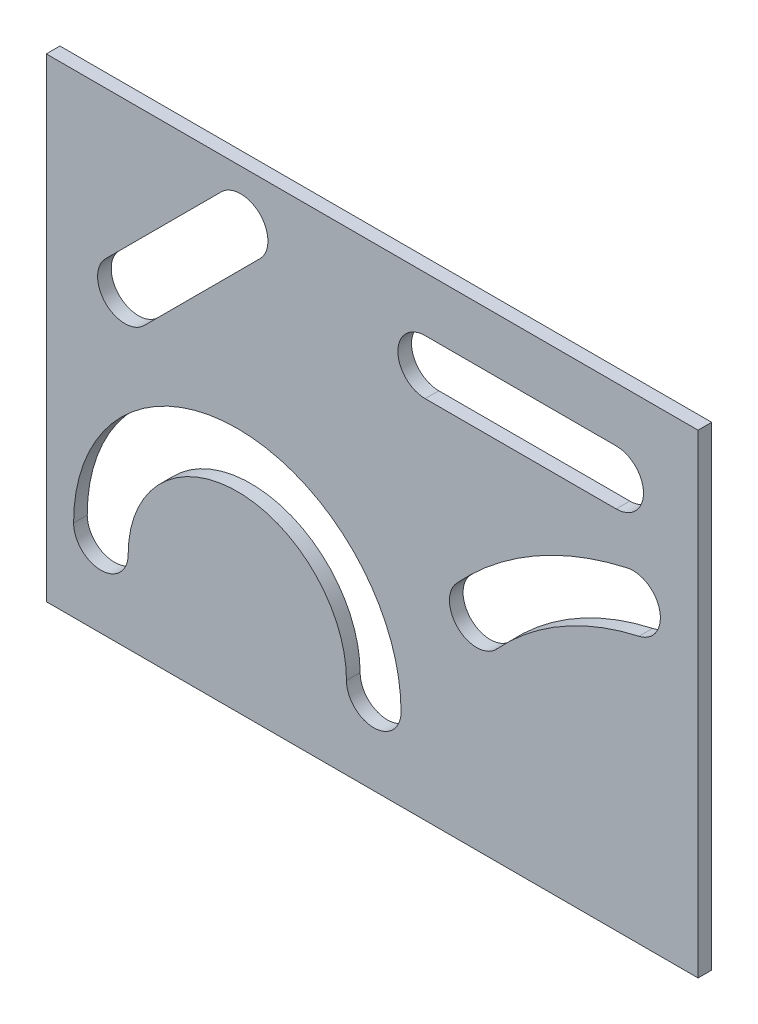
from build123d import *

# Parameters (mm, degrees)
SKETCH1_W           = 477.670351936
SKETCH1_H           = 347.715917952
BOSS_EXTRUDE1_DEPTH = 10
CUT_EXTRUDE1_DEPTH  = 10


with BuildPart() as part:
    # Sketch1 → Boss-Extrude1 (new body)
    with BuildSketch(Plane.XY):
        Rectangle(SKETCH1_W, SKETCH1_H)
    extrude(amount=BOSS_EXTRUDE1_DEPTH)

    # Sketch2 → Cut-Extrude1 (cut)
    with BuildSketch(Plane.XY.offset(10)):
        with BuildLine():
            Line((-195.403718463, 65.573687729), (-110.55090472, 150.426501471))
            ThreePointArc((-110.55090472, 150.426501471), (-82.266633473, 150.426501471), (-82.266633473, 122.142230224))
            Line((-82.266633473, 122.142230224), (-167.119447215, 37.289416482))
            ThreePointArc((-167.119447215, 37.289416482), (-195.403718463, 37.289416482), (-195.403718463, 65.573687729))
        make_face()
        with BuildLine():
            Line((38.835175968, 133.857958976), (178.835175968, 133.857958976))
            ThreePointArc((178.835175968, 133.857958976), (198.835175968, 113.857958976), (178.835175968, 93.857958976))
            Line((178.835175968, 93.857958976), (38.835175968, 93.857958976))
            ThreePointArc((38.835175968, 93.857958976), (18.835175968, 113.857958976), (38.835175968, 133.857958976))
        make_face()
        with BuildLine():
            ThreePointArc((21.164824032, -113.857958976), (-98.835175968, 6.142041024), (-218.835175968, -113.857958976))
            ThreePointArc((-218.835175968, -113.857958976), (-198.835175968, -133.857958976), (-178.835175968, -113.857958976))
            ThreePointArc((-178.835175968, -113.857958976), (-98.835175968, -33.857958976), (-18.835175968, -113.857958976))
            ThreePointArc((-18.835175968, -113.857958976), (1.164824032, -133.857958976), (21.164824032, -113.857958976))
        make_face()
        with BuildLine():
            ThreePointArc((186.889668623, 60.453082732), (118.835175968, 33.988137932), (61.888615133, -11.716309149))
            ThreePointArc((61.888615133, -11.716309149), (63.122357717, -39.973660037), (91.379708606, -38.739917453))
            ThreePointArc((91.379708606, -38.739917453), (138.835175968, -0.65287822), (195.54725318, 21.401242448))
            ThreePointArc((195.54725318, 21.401242448), (210.744381044, 45.255954869), (186.889668623, 60.453082732))
        make_face()
    extrude(amount=-CUT_EXTRUDE1_DEPTH, mode=Mode.SUBTRACT)


solid = part.part
